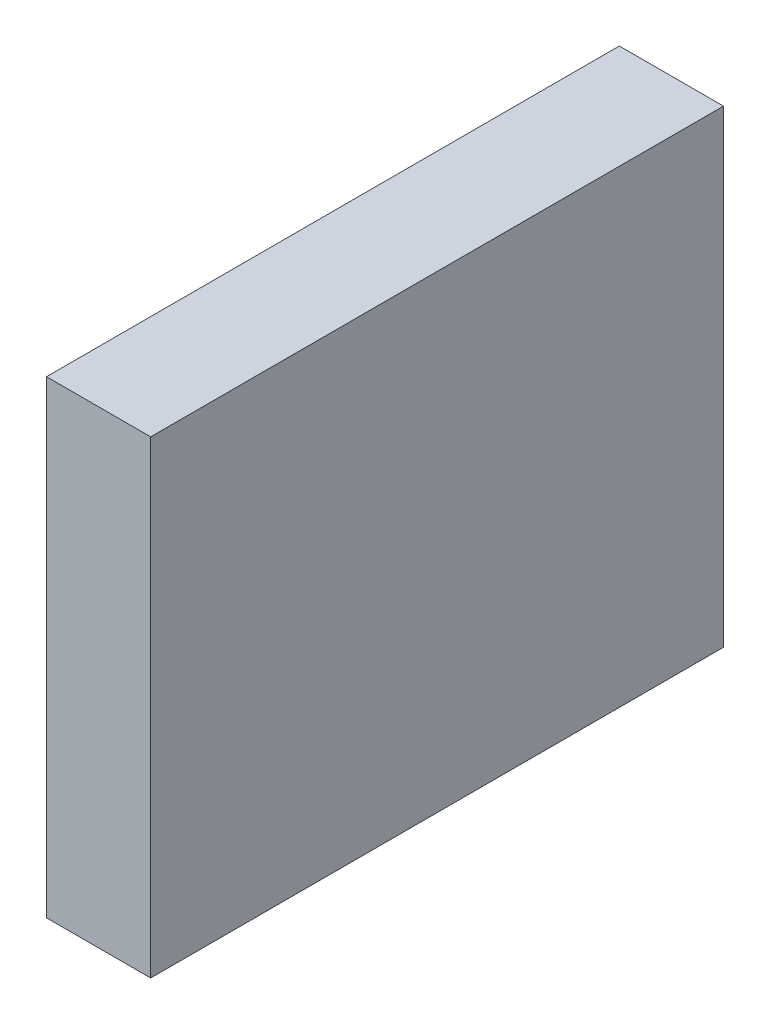
from build123d import *

# Parameters (mm, degrees)
SKETCH_1_W           = 4
SKETCH_1_H           = 18
PITCH_YOKE_ARM_DEPTH = 22


with BuildPart() as part:
    # 草图1 → Pitch_Yoke_Arm (new body)
    with BuildSketch(Plane.XY):
        with Locations((2, 9)):
            Rectangle(SKETCH_1_W, SKETCH_1_H)
    extrude(amount=PITCH_YOKE_ARM_DEPTH)


solid = part.part
